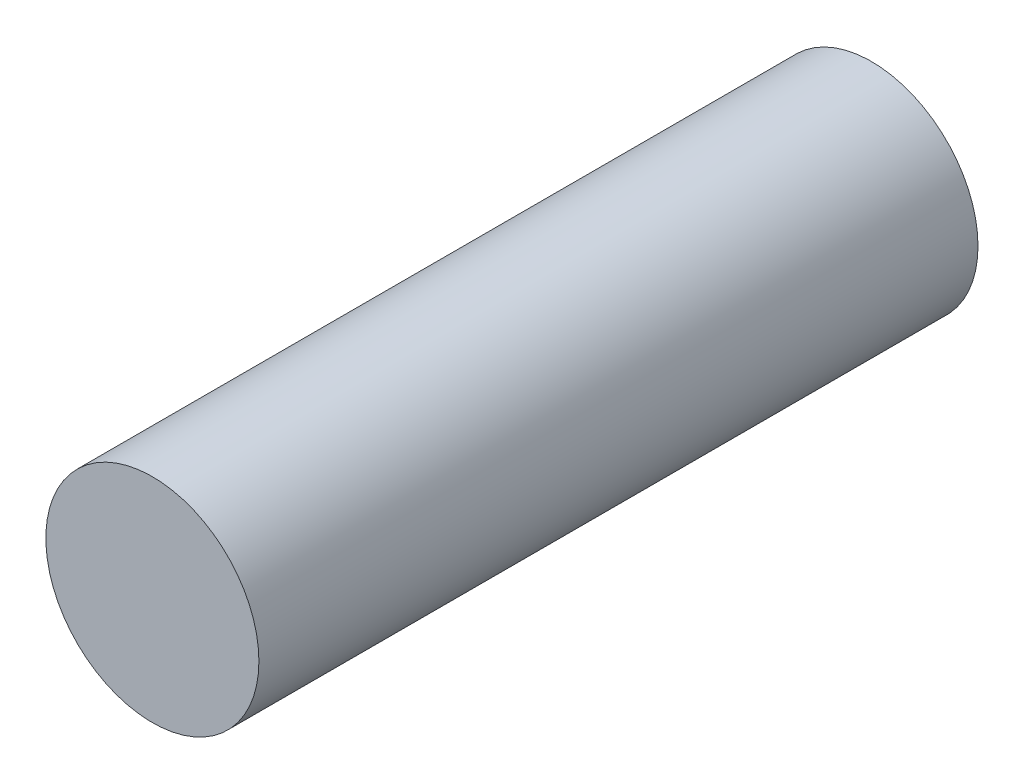
from build123d import *

# Parameters (mm, degrees)
SKETCH_1_R      = 2
EXTRUDE_1_DEPTH = 13.5


with BuildPart() as part:
    # 草图1 → 凸台-拉伸1 (new body)
    with BuildSketch(Plane.XY):
        Circle(SKETCH_1_R)
    extrude(amount=EXTRUDE_1_DEPTH)


solid = part.part
